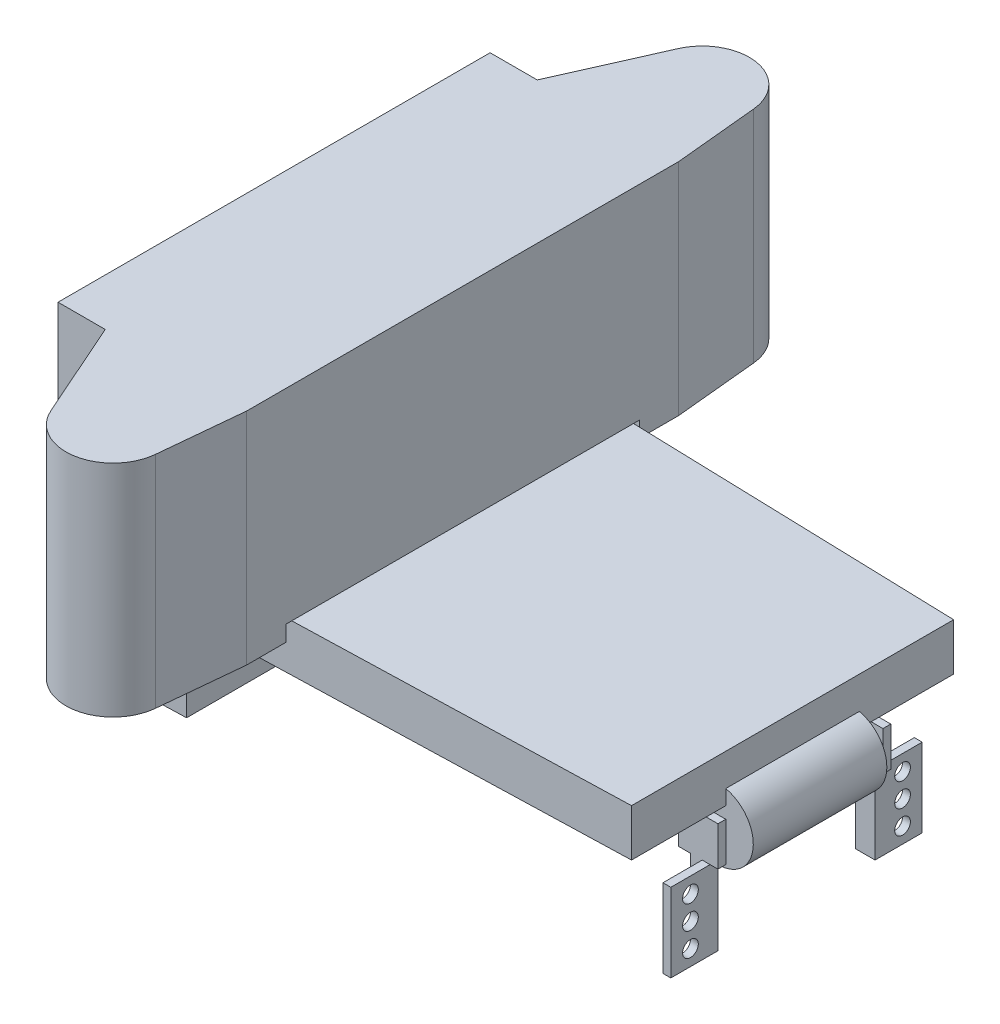
from build123d import *

# Parameters (mm, degrees)
SKETCH_1_W          = 24
SKETCH_1_H          = 55
SKETCH_1_R          = 6
EXTRUDE_1_DEPTH     = 28
SKETCH_2_W          = 18
SKETCH_2_H          = 45
CUT_EXTRUDE_1_DEPTH = 2
EXTRUDE_2_DEPTH     = 6
EXTRUDE_3_DEPTH     = 11
SKETCH_5_R          = 4.5
EXTRUDE_4_DEPTH     = 8.5
SKETCH_7_R          = 1
EXTRUDE_5_DEPTH     = 11
EXTRUDE_START       = 1.5
SKETCH_8_R          = 1
EXTRUDE_6_DEPTH     = 1
SKETCH_9_W          = 1
SKETCH_9_H          = 10
EXTRUDE_7_DEPTH     = 5
SKETCH_10_R         = 1
CUT_EXTRUDE_2_DEPTH = 1


with BuildPart() as part:
    # Эскиз1 → Бобышка-Вытянуть1 (new body)
    with BuildSketch(Plane(origin=(0, 0, 0), x_dir=(1, 0, 0), z_dir=(0, 1, 0))):
        Rectangle(SKETCH_1_W, SKETCH_1_H)
        with Locations((5, 37.5)):
            Circle(SKETCH_1_R)
        with BuildLine():
            Line((10.971870797, -38.080309558), (12, -27.5))
            Line((12, -27.5), (-6, -27.5))
            Line((-6, -27.5), (-0.484562129, -39.933018342))
            ThreePointArc((-0.484562129, -39.933018342), (3.75649141, -31.630273738), (11, -37.5))
            ThreePointArc((11, -37.5), (10.992963573, -37.790495454), (10.971870797, -38.080309558))
        make_face()
        with Locations((5, -37.5)):
            Circle(SKETCH_1_R)
        with BuildLine():
            Line((-6, 27.5), (12, 27.5))
            Line((12, 27.5), (10.971870797, 38.080309558))
            ThreePointArc((10.971870797, 38.080309558), (10.992963573, 37.790495454), (11, 37.5))
            ThreePointArc((11, 37.5), (3.75649141, 31.630273738), (-0.484562129, 39.933018342))
            Line((-0.484562129, 39.933018342), (-6, 27.5))
        make_face()
    extrude(amount=EXTRUDE_1_DEPTH)

    # Эскиз2 → Вырез-Вытянуть1 (cut)
    with BuildSketch(Plane.XZ):
        with Locations((3, 0)):
            Rectangle(SKETCH_2_W, SKETCH_2_H)
    extrude(amount=-CUT_EXTRUDE_1_DEPTH, mode=Mode.SUBTRACT)


with BuildPart() as body_2:
    # Эскиз3 → Бобышка-Вытянуть2 (new body)
    with BuildSketch(Plane.XZ.offset(-2)):
        Polygon((-4, 22.226190476), (54, 20.5), (54, -20.5), (-4, -22.226190476), align=None)
    extrude(amount=EXTRUDE_2_DEPTH)

    # Эскиз4 → Бобышка-Вытянуть3 (add)
    with BuildSketch(Plane.XZ.offset(4)):
        Polygon((-1, 22.136904762), (-4, 22.226190476), (-4, -22.226190476), (-1, -22.136904762), align=None)
    extrude(amount=EXTRUDE_3_DEPTH)

    # Эскиз5 → Бобышка-Вытянуть4 (add, symmetric)
    with BuildSketch(Plane.XY):
        with Locations((53, -6.5)):
            Circle(SKETCH_5_R)
    extrude(amount=EXTRUDE_4_DEPTH, both=True)

    # Эскиз7 → Бобышка-Вытянуть5 (add, symmetric)
    with BuildSketch(Plane.XY):
        with Locations((53, -6.5)):
            Circle(SKETCH_7_R)
    extrude(amount=EXTRUDE_5_DEPTH, both=True)

    # Эскиз8 → Бобышка-Вытянуть6 (add)
    # profile 1 of 3: a face of its own
    with BuildSketch(Plane(origin=(0, 0, -8.5), x_dir=(-1, 0, 0), z_dir=(0, 0, -1)).offset(EXTRUDE_START)):
        with BuildLine():
            Line((-52, -9), (-54.5, -9))
            Line((-54.5, -9), (-54.5, -10.742640687))
            ThreePointArc((-54.5, -10.742640687), (-53.260278246, -10.992466498), (-52, -10.887482194))
            Line((-52, -10.887482194), (-52, -9))
        make_face()
    # profile 2 of 3: a face of its own
    with BuildSketch(Plane(origin=(0, 0, -8.5), x_dir=(-1, 0, 0), z_dir=(0, 0, -1)).offset(EXTRUDE_START)):
        Polygon((-55.5, -9), (-54.5, -9), (-52, -9), (-50.5, -9), (-50.5, -4), (-54, -4), (-55.5, -4), align=None)
        with Locations((-53, -6.5)):
            Circle(SKETCH_8_R, mode=Mode.SUBTRACT)
    # profile 3 of 3: a face of its own
    with BuildSketch(Plane(origin=(0, 0, -8.5), x_dir=(-1, 0, 0), z_dir=(0, 0, -1)).offset(EXTRUDE_START)):
        with BuildLine():
            ThreePointArc((-52, -10.887482194), (-53.260278246, -10.992466498), (-54.5, -10.742640687))
            Line((-54.5, -10.742640687), (-54.5, -19))
            Line((-54.5, -19), (-52, -19))
            Line((-52, -19), (-52, -10.887482194))
        make_face()
    extrude_6 = extrude(amount=EXTRUDE_6_DEPTH)

    # Зеркальное отражение1: Бобышка-Вытянуть6 across plane
    add(extrude_6.mirror(Plane.XY))

    # Эскиз9 → Бобышка-Вытянуть7 (add)
    with BuildSketch(Plane(origin=(0, 0, -11), x_dir=(-1, 0, 0), z_dir=(0, 0, -1))):
        with Locations((-54, -14)):
            Rectangle(SKETCH_9_W, SKETCH_9_H)
    extrude_7 = extrude(amount=EXTRUDE_7_DEPTH)

    # Зеркальное отражение2: Бобышка-Вытянуть7 across plane
    add(extrude_7.mirror(Plane.XY))

    # Эскиз10 → Вырез-Вытянуть2 (cut)
    with BuildSketch(Plane(origin=(54.5, 0, 0), x_dir=(0, 0, -1), z_dir=(1, 0, 0))):
        with Locations((13.5, -11)):
            Circle(SKETCH_10_R)
        with Locations((13.5, -14)):
            Circle(SKETCH_10_R)
        with Locations((13.5, -17)):
            Circle(SKETCH_10_R)
    cut_extrude_2 = extrude(amount=-CUT_EXTRUDE_2_DEPTH, mode=Mode.SUBTRACT)

    # Зеркальное отражение3: Вырез-Вытянуть2 across plane
    add(cut_extrude_2.mirror(Plane.XY), mode=Mode.SUBTRACT)


solid = Compound([part.part, body_2.part])
